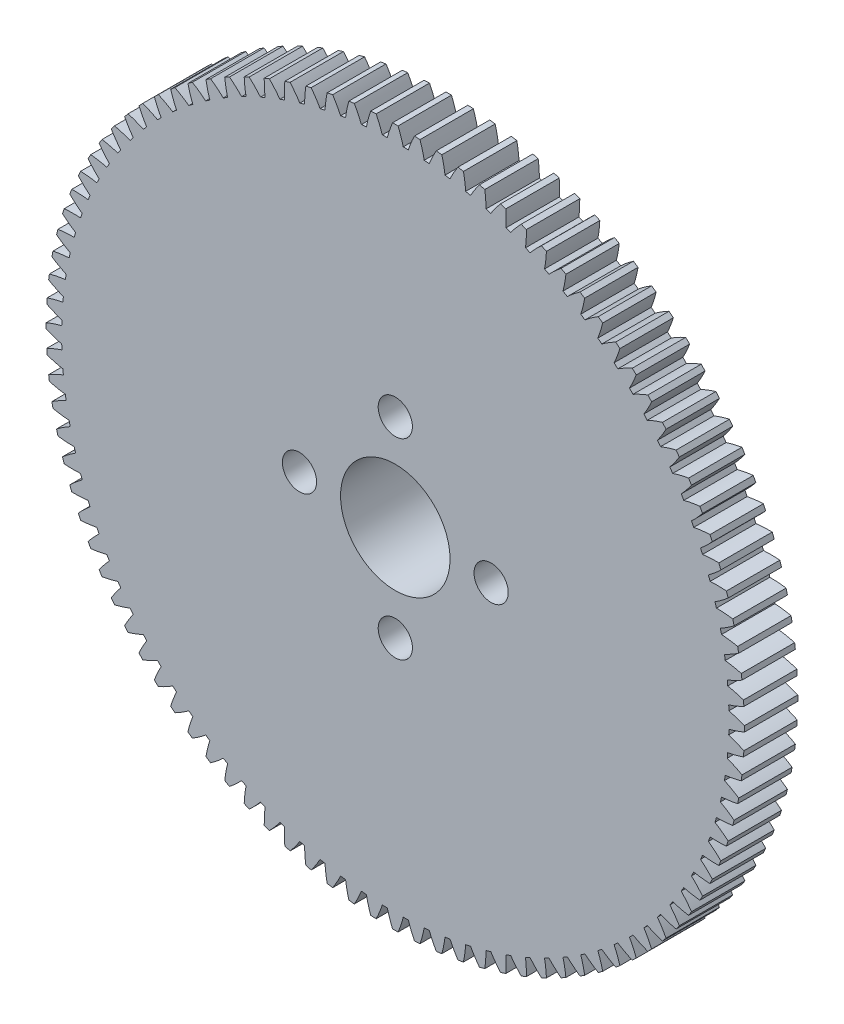
from build123d import *

# Parameters (mm, degrees)
BOSS_EXTRUDE1_DEPTH = 3.9
SKETCH3_R           = 10
BOSS_EXTRUDE2_DEPTH = 4
SKETCH2_R           = 4
SKETCH2_R_2         = 1.25
CUT_EXTRUDE1_DEPTH  = 37.916507893


with BuildPart() as part:
    # Sketch1 → Boss-Extrude1 (new body)
    with BuildSketch(Plane.XY.offset(4.1)):
        with BuildLine():
            Line((25.499201507, -0.201798183), (25.499201507, 0.201798183))
            ThreePointArc((25.499201507, 0.201798183), (24.94053741, 0.412222952), (24.368062617, 0.581506053))
            ThreePointArc((24.368062617, 0.581506053), (24.362972409, 0.765637253), (24.356490879, 0.949724728))
            ThreePointArc((24.356490879, 0.949724728), (24.917148309, 1.154763051), (25.46155567, 1.39970813))
            Line((25.46155567, 1.39970813), (25.436213645, 1.802508091))
            ThreePointArc((25.436213645, 1.802508091), (24.865439263, 1.977438825), (24.283464745, 2.110441895))
            ThreePointArc((24.283464745, 2.110441895), (24.266822887, 2.293890137), (24.248795199, 2.47720738))
            ThreePointArc((24.248795199, 2.47720738), (24.795471836, 2.717045077), (25.323424706, 2.995690434))
            Line((25.323424706, 2.995690434), (25.272840668, 3.396104322))
            ThreePointArc((25.272840668, 3.396104322), (24.692208588, 3.534850651), (24.103031131, 3.631048787))
            ThreePointArc((24.103031131, 3.631048787), (24.074903302, 3.813090085), (24.045400602, 3.994913625))
            ThreePointArc((24.045400602, 3.994913625), (24.575938965, 4.268604168), (25.085353753, 4.579850117))
            Line((25.085353753, 4.579850117), (25.009727335, 4.976297682))
            ThreePointArc((25.009727335, 4.976297682), (24.421529045, 5.078312037), (23.827473865, 5.137325589))
            ThreePointArc((23.827473865, 5.137325589), (23.787971072, 5.317241509), (23.747109795, 5.496853772))
            ThreePointArc((23.747109795, 5.496853772), (24.25941609, 5.803317028), (24.748282369, 6.145935223))
            Line((24.748282369, 6.145935223), (24.647912034, 6.536851868))
            ThreePointArc((24.647912034, 6.536851868), (24.054468885, 6.601731644), (23.457880446, 6.623327714))
            ThreePointArc((23.457880446, 6.623327714), (23.407158588, 6.80040821), (23.355099994, 6.977100348))
            ThreePointArc((23.355099994, 6.977100348), (23.847152382, 7.315126847), (24.313540822, 7.687765132))
            Line((24.313540822, 7.687765132), (24.188822685, 8.071608086))
            ThreePointArc((24.188822685, 8.071608086), (23.592476726, 8.099097233), (22.995709489, 8.083190589))
            ThreePointArc((22.995709489, 8.083190589), (22.933968743, 8.256736806), (22.870918284, 8.429811496))
            ThreePointArc((22.870918284, 8.429811496), (23.340774859, 8.798067203), (23.782844836, 9.199254943))
            Line((23.782844836, 9.199254943), (23.634271104, 9.574509354))
            ThreePointArc((23.634271104, 9.574509354), (23.037375839, 9.564499385), (22.442784972, 9.511152805))
            ThreePointArc((22.442784972, 9.511152805), (22.370269001, 9.680479834), (22.296475507, 9.84925403))
            ThreePointArc((22.296475507, 9.84925403), (22.742281961, 10.246285607), (23.158288827, 10.674439498))
            Line((23.158288827, 10.674439498), (22.986445852, 11.039624408))
            ThreePointArc((22.986445852, 11.039624408), (22.391356955, 10.992154828), (21.801289037, 10.901578846))
            ThreePointArc((21.801289037, 10.901578846), (21.718284027, 11.066018431), (21.634038729, 11.229826058))
            ThreePointArc((21.634038729, 11.229826058), (22.054035666, 11.654066602), (22.442337633, 12.107496917))
            Line((22.442337633, 12.107496917), (22.2479036, 12.461171109))
            ThreePointArc((22.2479036, 12.461171109), (21.656969615, 12.376429258), (21.073753374, 12.248981335))
            ThreePointArc((21.073753374, 12.248981335), (20.980586908, 12.407884509), (20.886222283, 12.566079093))
            ThreePointArc((20.886222283, 12.566079093), (21.278752168, 13.015854321), (21.637816784, 13.492771577))
            Line((21.637816784, 13.492771577), (21.421559037, 13.833539259))
            ThreePointArc((21.421559037, 13.833539259), (20.837112109, 13.711859575), (20.263049233, 13.548042691))
            ThreePointArc((20.263049233, 13.548042691), (20.160088998, 13.700782335), (20.055977459, 13.852739554))
            ThreePointArc((20.055977459, 13.852739554), (20.419491156, 14.326274409), (20.747901358, 14.824796431))
            Line((20.747901358, 14.824796431), (20.510673366, 15.151312751))
            ThreePointArc((20.510673366, 15.151312751), (19.935020042, 14.993175447), (19.372376095, 14.793636112))
            ThreePointArc((19.372376095, 14.793636112), (19.260028427, 14.939609433), (19.146580856, 15.084729581))
            ThreePointArc((19.146580856, 15.084729581), (19.479643742, 15.580155238), (19.776103444, 16.098314587))
            Line((19.776103444, 16.098314587), (19.518841438, 16.409290932))
            ThreePointArc((19.518841438, 16.409290932), (18.954253558, 16.215320106), (18.405249039, 15.98084581))
            ThreePointArc((18.405249039, 15.98084581), (18.283957322, 16.119476717), (18.161621444, 16.257187072))
            ThreePointArc((18.161621444, 16.257187072), (18.462919073, 16.772548311), (18.726258285, 17.30830005))
            Line((18.726258285, 17.30830005), (18.449977561, 17.60250914))
            ThreePointArc((18.449977561, 17.60250914), (17.898683294, 17.373470304), (17.365484873, 17.104986411))
            ThreePointArc((17.365484873, 17.104986411), (17.235727791, 17.235727791), (17.104986411, 17.365484873))
            ThreePointArc((17.104986411, 17.365484873), (17.373329697, 17.898747799), (17.60250914, 18.449977561))
            Line((17.60250914, 18.449977561), (17.30830005, 18.726258285))
            ThreePointArc((17.30830005, 18.726258285), (16.772475105, 18.463055352), (16.257187072, 18.161621444))
            ThreePointArc((16.257187072, 18.161621444), (16.119476717, 18.283957322), (15.98084581, 18.405249039))
            ThreePointArc((15.98084581, 18.405249039), (16.215175727, 18.954309106), (16.409290932, 19.518841438))
            Line((16.409290932, 19.518841438), (16.098314587, 19.776103444))
            ThreePointArc((16.098314587, 19.776103444), (15.580073619, 19.479775155), (15.084729581, 19.146580856))
            ThreePointArc((15.084729581, 19.146580856), (14.939609433, 19.260028427), (14.793636112, 19.372376095))
            ThreePointArc((14.793636112, 19.372376095), (14.993027865, 19.935066415), (15.151312751, 20.510673366))
            Line((15.151312751, 20.510673366), (14.824796431, 20.747901358))
            ThreePointArc((14.824796431, 20.747901358), (14.3261847, 20.419617185), (13.852739554, 20.055977459))
            ThreePointArc((13.852739554, 20.055977459), (13.700782335, 20.160088998), (13.548042691, 20.263049233))
            ThreePointArc((13.548042691, 20.263049233), (13.711709373, 20.837149124), (13.833539259, 21.421559037))
            Line((13.833539259, 21.421559037), (13.492771577, 21.637816784))
            ThreePointArc((13.492771577, 21.637816784), (13.015756876, 21.278872315), (12.566079093, 20.886222283))
            ThreePointArc((12.566079093, 20.886222283), (12.407884509, 20.980586908), (12.248981335, 21.073753374))
            ThreePointArc((12.248981335, 21.073753374), (12.376277027, 21.656997125), (12.461171109, 22.2479036))
            Line((12.461171109, 22.2479036), (12.107496917, 22.442337633))
            ThreePointArc((12.107496917, 22.442337633), (11.653961805, 22.054149458), (11.229826058, 21.634038729))
            ThreePointArc((11.229826058, 21.634038729), (11.066018431, 21.718284027), (10.901578846, 21.801289037))
            ThreePointArc((10.901578846, 21.801289037), (10.992001171, 22.391374853), (11.039624408, 22.986445852))
            Line((11.039624408, 22.986445852), (10.674439498, 23.158288827))
            ThreePointArc((10.674439498, 23.158288827), (10.246173871, 22.742388948), (9.84925403, 22.296475507))
            ThreePointArc((9.84925403, 22.296475507), (9.680479834, 22.370269001), (9.511152805, 22.442784972))
            ThreePointArc((9.511152805, 22.442784972), (9.564344907, 23.037384054), (9.574509354, 23.634271104))
            Line((9.574509354, 23.634271104), (9.199254943, 23.782844836))
            ThreePointArc((9.199254943, 23.782844836), (8.79794897, 23.340874619), (8.429811496, 22.870918284))
            ThreePointArc((8.429811496, 22.870918284), (8.256736806, 22.933968743), (8.083190589, 22.995709489))
            ThreePointArc((8.083190589, 22.995709489), (8.098942544, 23.592475224), (8.071608086, 24.188822685))
            Line((8.071608086, 24.188822685), (7.687765132, 24.313540822))
            ThreePointArc((7.687765132, 24.313540822), (7.315002584, 23.847244521), (6.977100348, 23.355099994))
            ThreePointArc((6.977100348, 23.355099994), (6.80040821, 23.407158588), (6.623327714, 23.457880446))
            ThreePointArc((6.623327714, 23.457880446), (6.601577355, 24.054457674), (6.536851868, 24.647912034))
            Line((6.536851868, 24.647912034), (6.145935223, 24.748282369))
            ThreePointArc((6.145935223, 24.748282369), (5.803187224, 24.259500244), (5.496853772, 23.747109795))
            ThreePointArc((5.496853772, 23.747109795), (5.317241509, 23.787971072), (5.137325589, 23.827473865))
            ThreePointArc((5.137325589, 23.827473865), (5.078158755, 24.421508168), (4.976297682, 25.009727335))
            Line((4.976297682, 25.009727335), (4.579850117, 25.085353753))
            ThreePointArc((4.579850117, 25.085353753), (4.268469336, 24.576014803), (3.994913625, 24.045400602))
            ThreePointArc((3.994913625, 24.045400602), (3.813090085, 24.074903302), (3.631048787, 24.103031131))
            ThreePointArc((3.631048787, 24.103031131), (3.534698983, 24.692178127), (3.396104322, 25.272840668))
            Line((3.396104322, 25.272840668), (2.995690434, 25.323424706))
            ThreePointArc((2.995690434, 25.323424706), (2.71690575, 24.795539059), (2.47720738, 24.248795199))
            ThreePointArc((2.47720738, 24.248795199), (2.293890137, 24.266822887), (2.110441895, 24.283464745))
            ThreePointArc((2.110441895, 24.283464745), (1.97728937, 24.865399339), (1.802508091, 25.436213645))
            Line((1.802508091, 25.436213645), (1.39970813, 25.46155567))
            ThreePointArc((1.39970813, 25.46155567), (1.154619777, 24.91720665), (0.949724728, 24.356490879))
            ThreePointArc((0.949724728, 24.356490879), (0.765637253, 24.362972409), (0.581506053, 24.368062617))
            ThreePointArc((0.581506053, 24.368062617), (0.412076298, 24.94048818), (0.201798183, 25.499201507))
            Line((0.201798183, 25.499201507), (-0.201798183, 25.499201507))
            ThreePointArc((-0.201798183, 25.499201507), (-0.412222952, 24.94053741), (-0.581506053, 24.368062617))
            ThreePointArc((-0.581506053, 24.368062617), (-0.765637253, 24.362972409), (-0.949724728, 24.356490879))
            ThreePointArc((-0.949724728, 24.356490879), (-1.154763051, 24.917148309), (-1.39970813, 25.46155567))
            Line((-1.39970813, 25.46155567), (-1.802508091, 25.436213645))
            ThreePointArc((-1.802508091, 25.436213645), (-1.977438825, 24.865439263), (-2.110441895, 24.283464745))
            ThreePointArc((-2.110441895, 24.283464745), (-2.293890137, 24.266822887), (-2.47720738, 24.248795199))
            ThreePointArc((-2.47720738, 24.248795199), (-2.717045077, 24.795471836), (-2.995690434, 25.323424706))
            Line((-2.995690434, 25.323424706), (-3.396104322, 25.272840668))
            ThreePointArc((-3.396104322, 25.272840668), (-3.534850651, 24.692208588), (-3.631048787, 24.103031131))
            ThreePointArc((-3.631048787, 24.103031131), (-3.813090085, 24.074903302), (-3.994913625, 24.045400602))
            ThreePointArc((-3.994913625, 24.045400602), (-4.268604168, 24.575938965), (-4.579850117, 25.085353753))
            Line((-4.579850117, 25.085353753), (-4.976297682, 25.009727335))
            ThreePointArc((-4.976297682, 25.009727335), (-5.078312037, 24.421529045), (-5.137325589, 23.827473865))
            ThreePointArc((-5.137325589, 23.827473865), (-5.317241509, 23.787971072), (-5.496853772, 23.747109795))
            ThreePointArc((-5.496853772, 23.747109795), (-5.803317028, 24.25941609), (-6.145935223, 24.748282369))
            Line((-6.145935223, 24.748282369), (-6.536851868, 24.647912034))
            ThreePointArc((-6.536851868, 24.647912034), (-6.601731644, 24.054468885), (-6.623327714, 23.457880446))
            ThreePointArc((-6.623327714, 23.457880446), (-6.80040821, 23.407158588), (-6.977100348, 23.355099994))
            ThreePointArc((-6.977100348, 23.355099994), (-7.315126847, 23.847152382), (-7.687765132, 24.313540822))
            Line((-7.687765132, 24.313540822), (-8.071608086, 24.188822685))
            ThreePointArc((-8.071608086, 24.188822685), (-8.099097233, 23.592476726), (-8.083190589, 22.995709489))
            ThreePointArc((-8.083190589, 22.995709489), (-8.256736806, 22.933968743), (-8.429811496, 22.870918284))
            ThreePointArc((-8.429811496, 22.870918284), (-8.798067203, 23.340774859), (-9.199254943, 23.782844836))
            Line((-9.199254943, 23.782844836), (-9.574509354, 23.634271104))
            ThreePointArc((-9.574509354, 23.634271104), (-9.564499385, 23.037375839), (-9.511152805, 22.442784972))
            ThreePointArc((-9.511152805, 22.442784972), (-9.680479834, 22.370269001), (-9.84925403, 22.296475507))
            ThreePointArc((-9.84925403, 22.296475507), (-10.246285607, 22.742281961), (-10.674439498, 23.158288827))
            Line((-10.674439498, 23.158288827), (-11.039624408, 22.986445852))
            ThreePointArc((-11.039624408, 22.986445852), (-10.992154828, 22.391356955), (-10.901578846, 21.801289037))
            ThreePointArc((-10.901578846, 21.801289037), (-11.066018431, 21.718284027), (-11.229826058, 21.634038729))
            ThreePointArc((-11.229826058, 21.634038729), (-11.654066602, 22.054035666), (-12.107496917, 22.442337633))
            Line((-12.107496917, 22.442337633), (-12.461171109, 22.2479036))
            ThreePointArc((-12.461171109, 22.2479036), (-12.376429258, 21.656969615), (-12.248981335, 21.073753374))
            ThreePointArc((-12.248981335, 21.073753374), (-12.407884509, 20.980586908), (-12.566079093, 20.886222283))
            ThreePointArc((-12.566079093, 20.886222283), (-13.015854321, 21.278752168), (-13.492771577, 21.637816784))
            Line((-13.492771577, 21.637816784), (-13.833539259, 21.421559037))
            ThreePointArc((-13.833539259, 21.421559037), (-13.711859575, 20.837112109), (-13.548042691, 20.263049233))
            ThreePointArc((-13.548042691, 20.263049233), (-13.700782335, 20.160088998), (-13.852739554, 20.055977459))
            ThreePointArc((-13.852739554, 20.055977459), (-14.326274409, 20.419491156), (-14.824796431, 20.747901358))
            Line((-14.824796431, 20.747901358), (-15.151312751, 20.510673366))
            ThreePointArc((-15.151312751, 20.510673366), (-14.993175447, 19.935020042), (-14.793636112, 19.372376095))
            ThreePointArc((-14.793636112, 19.372376095), (-14.939609433, 19.260028427), (-15.084729581, 19.146580856))
            ThreePointArc((-15.084729581, 19.146580856), (-15.580155238, 19.479643742), (-16.098314587, 19.776103444))
            Line((-16.098314587, 19.776103444), (-16.409290932, 19.518841438))
            ThreePointArc((-16.409290932, 19.518841438), (-16.215320106, 18.954253558), (-15.98084581, 18.405249039))
            ThreePointArc((-15.98084581, 18.405249039), (-16.119476717, 18.283957322), (-16.257187072, 18.161621444))
            ThreePointArc((-16.257187072, 18.161621444), (-16.772548311, 18.462919073), (-17.30830005, 18.726258285))
            Line((-17.30830005, 18.726258285), (-17.60250914, 18.449977561))
            ThreePointArc((-17.60250914, 18.449977561), (-17.373470304, 17.898683294), (-17.104986411, 17.365484873))
            ThreePointArc((-17.104986411, 17.365484873), (-17.235727791, 17.235727791), (-17.365484873, 17.104986411))
            ThreePointArc((-17.365484873, 17.104986411), (-17.898747799, 17.373329697), (-18.449977561, 17.60250914))
            Line((-18.449977561, 17.60250914), (-18.726258285, 17.30830005))
            ThreePointArc((-18.726258285, 17.30830005), (-18.463055352, 16.772475105), (-18.161621444, 16.257187072))
            ThreePointArc((-18.161621444, 16.257187072), (-18.283957322, 16.119476717), (-18.405249039, 15.98084581))
            ThreePointArc((-18.405249039, 15.98084581), (-18.954309106, 16.215175727), (-19.518841438, 16.409290932))
            Line((-19.518841438, 16.409290932), (-19.776103444, 16.098314587))
            ThreePointArc((-19.776103444, 16.098314587), (-19.479775155, 15.580073619), (-19.146580856, 15.084729581))
            ThreePointArc((-19.146580856, 15.084729581), (-19.260028427, 14.939609433), (-19.372376095, 14.793636112))
            ThreePointArc((-19.372376095, 14.793636112), (-19.935066415, 14.993027865), (-20.510673366, 15.151312751))
            Line((-20.510673366, 15.151312751), (-20.747901358, 14.824796431))
            ThreePointArc((-20.747901358, 14.824796431), (-20.419617185, 14.3261847), (-20.055977459, 13.852739554))
            ThreePointArc((-20.055977459, 13.852739554), (-20.160088998, 13.700782335), (-20.263049233, 13.548042691))
            ThreePointArc((-20.263049233, 13.548042691), (-20.837149124, 13.711709373), (-21.421559037, 13.833539259))
            Line((-21.421559037, 13.833539259), (-21.637816784, 13.492771577))
            ThreePointArc((-21.637816784, 13.492771577), (-21.278872315, 13.015756876), (-20.886222283, 12.566079093))
            ThreePointArc((-20.886222283, 12.566079093), (-20.980586908, 12.407884509), (-21.073753374, 12.248981335))
            ThreePointArc((-21.073753374, 12.248981335), (-21.656997125, 12.376277027), (-22.2479036, 12.461171109))
            Line((-22.2479036, 12.461171109), (-22.442337633, 12.107496917))
            ThreePointArc((-22.442337633, 12.107496917), (-22.054149458, 11.653961805), (-21.634038729, 11.229826058))
            ThreePointArc((-21.634038729, 11.229826058), (-21.718284027, 11.066018431), (-21.801289037, 10.901578846))
            ThreePointArc((-21.801289037, 10.901578846), (-22.391374853, 10.992001171), (-22.986445852, 11.039624408))
            Line((-22.986445852, 11.039624408), (-23.158288827, 10.674439498))
            ThreePointArc((-23.158288827, 10.674439498), (-22.742388948, 10.246173871), (-22.296475507, 9.84925403))
            ThreePointArc((-22.296475507, 9.84925403), (-22.370269001, 9.680479834), (-22.442784972, 9.511152805))
            ThreePointArc((-22.442784972, 9.511152805), (-23.037384054, 9.564344907), (-23.634271104, 9.574509354))
            Line((-23.634271104, 9.574509354), (-23.782844836, 9.199254943))
            ThreePointArc((-23.782844836, 9.199254943), (-23.340874619, 8.79794897), (-22.870918284, 8.429811496))
            ThreePointArc((-22.870918284, 8.429811496), (-22.933968743, 8.256736806), (-22.995709489, 8.083190589))
            ThreePointArc((-22.995709489, 8.083190589), (-23.592475224, 8.098942544), (-24.188822685, 8.071608086))
            Line((-24.188822685, 8.071608086), (-24.313540822, 7.687765132))
            ThreePointArc((-24.313540822, 7.687765132), (-23.847244521, 7.315002584), (-23.355099994, 6.977100348))
            ThreePointArc((-23.355099994, 6.977100348), (-23.407158588, 6.80040821), (-23.457880446, 6.623327714))
            ThreePointArc((-23.457880446, 6.623327714), (-24.054457674, 6.601577355), (-24.647912034, 6.536851868))
            Line((-24.647912034, 6.536851868), (-24.748282369, 6.145935223))
            ThreePointArc((-24.748282369, 6.145935223), (-24.259500244, 5.803187224), (-23.747109795, 5.496853772))
            ThreePointArc((-23.747109795, 5.496853772), (-23.787971072, 5.317241509), (-23.827473865, 5.137325589))
            ThreePointArc((-23.827473865, 5.137325589), (-24.421508168, 5.078158755), (-25.009727335, 4.976297682))
            Line((-25.009727335, 4.976297682), (-25.085353753, 4.579850117))
            ThreePointArc((-25.085353753, 4.579850117), (-24.576014803, 4.268469336), (-24.045400602, 3.994913625))
            ThreePointArc((-24.045400602, 3.994913625), (-24.074903302, 3.813090085), (-24.103031131, 3.631048787))
            ThreePointArc((-24.103031131, 3.631048787), (-24.692178127, 3.534698983), (-25.272840668, 3.396104322))
            Line((-25.272840668, 3.396104322), (-25.323424706, 2.995690434))
            ThreePointArc((-25.323424706, 2.995690434), (-24.795539059, 2.71690575), (-24.248795199, 2.47720738))
            ThreePointArc((-24.248795199, 2.47720738), (-24.266822887, 2.293890137), (-24.283464745, 2.110441895))
            ThreePointArc((-24.283464745, 2.110441895), (-24.865399339, 1.97728937), (-25.436213645, 1.802508091))
            Line((-25.436213645, 1.802508091), (-25.46155567, 1.39970813))
            ThreePointArc((-25.46155567, 1.39970813), (-24.91720665, 1.154619777), (-24.356490879, 0.949724728))
            ThreePointArc((-24.356490879, 0.949724728), (-24.362972409, 0.765637253), (-24.368062617, 0.581506053))
            ThreePointArc((-24.368062617, 0.581506053), (-24.94048818, 0.412076298), (-25.499201507, 0.201798183))
            Line((-25.499201507, 0.201798183), (-25.499201507, -0.201798183))
            ThreePointArc((-25.499201507, -0.201798183), (-24.94053741, -0.412222952), (-24.368062617, -0.581506053))
            ThreePointArc((-24.368062617, -0.581506053), (-24.362972409, -0.765637253), (-24.356490879, -0.949724728))
            ThreePointArc((-24.356490879, -0.949724728), (-24.917148309, -1.154763051), (-25.46155567, -1.39970813))
            Line((-25.46155567, -1.39970813), (-25.436213645, -1.802508091))
            ThreePointArc((-25.436213645, -1.802508091), (-24.865439263, -1.977438825), (-24.283464745, -2.110441895))
            ThreePointArc((-24.283464745, -2.110441895), (-24.266822887, -2.293890137), (-24.248795199, -2.47720738))
            ThreePointArc((-24.248795199, -2.47720738), (-24.795471836, -2.717045077), (-25.323424706, -2.995690434))
            Line((-25.323424706, -2.995690434), (-25.272840668, -3.396104322))
            ThreePointArc((-25.272840668, -3.396104322), (-24.692208588, -3.534850651), (-24.103031131, -3.631048787))
            ThreePointArc((-24.103031131, -3.631048787), (-24.074903302, -3.813090085), (-24.045400602, -3.994913625))
            ThreePointArc((-24.045400602, -3.994913625), (-24.575938965, -4.268604168), (-25.085353753, -4.579850117))
            Line((-25.085353753, -4.579850117), (-25.009727335, -4.976297682))
            ThreePointArc((-25.009727335, -4.976297682), (-24.421529045, -5.078312037), (-23.827473865, -5.137325589))
            ThreePointArc((-23.827473865, -5.137325589), (-23.787971072, -5.317241509), (-23.747109795, -5.496853772))
            ThreePointArc((-23.747109795, -5.496853772), (-24.25941609, -5.803317028), (-24.748282369, -6.145935223))
            Line((-24.748282369, -6.145935223), (-24.647912034, -6.536851868))
            ThreePointArc((-24.647912034, -6.536851868), (-24.054468885, -6.601731644), (-23.457880446, -6.623327714))
            ThreePointArc((-23.457880446, -6.623327714), (-23.407158588, -6.80040821), (-23.355099994, -6.977100348))
            ThreePointArc((-23.355099994, -6.977100348), (-23.847152382, -7.315126847), (-24.313540822, -7.687765132))
            Line((-24.313540822, -7.687765132), (-24.188822685, -8.071608086))
            ThreePointArc((-24.188822685, -8.071608086), (-23.592476726, -8.099097233), (-22.995709489, -8.083190589))
            ThreePointArc((-22.995709489, -8.083190589), (-22.933968743, -8.256736806), (-22.870918284, -8.429811496))
            ThreePointArc((-22.870918284, -8.429811496), (-23.340774859, -8.798067203), (-23.782844836, -9.199254943))
            Line((-23.782844836, -9.199254943), (-23.634271104, -9.574509354))
            ThreePointArc((-23.634271104, -9.574509354), (-23.037375839, -9.564499385), (-22.442784972, -9.511152805))
            ThreePointArc((-22.442784972, -9.511152805), (-22.370269001, -9.680479834), (-22.296475507, -9.84925403))
            ThreePointArc((-22.296475507, -9.84925403), (-22.742281961, -10.246285607), (-23.158288827, -10.674439498))
            Line((-23.158288827, -10.674439498), (-22.986445852, -11.039624408))
            ThreePointArc((-22.986445852, -11.039624408), (-22.391356955, -10.992154828), (-21.801289037, -10.901578846))
            ThreePointArc((-21.801289037, -10.901578846), (-21.718284027, -11.066018431), (-21.634038729, -11.229826058))
            ThreePointArc((-21.634038729, -11.229826058), (-22.054035666, -11.654066602), (-22.442337633, -12.107496917))
            Line((-22.442337633, -12.107496917), (-22.2479036, -12.461171109))
            ThreePointArc((-22.2479036, -12.461171109), (-21.656969615, -12.376429258), (-21.073753374, -12.248981335))
            ThreePointArc((-21.073753374, -12.248981335), (-20.980586908, -12.407884509), (-20.886222283, -12.566079093))
            ThreePointArc((-20.886222283, -12.566079093), (-21.278752168, -13.015854321), (-21.637816784, -13.492771577))
            Line((-21.637816784, -13.492771577), (-21.421559037, -13.833539259))
            ThreePointArc((-21.421559037, -13.833539259), (-20.837112109, -13.711859575), (-20.263049233, -13.548042691))
            ThreePointArc((-20.263049233, -13.548042691), (-20.160088998, -13.700782335), (-20.055977459, -13.852739554))
            ThreePointArc((-20.055977459, -13.852739554), (-20.419491156, -14.326274409), (-20.747901358, -14.824796431))
            Line((-20.747901358, -14.824796431), (-20.510673366, -15.151312751))
            ThreePointArc((-20.510673366, -15.151312751), (-19.935020042, -14.993175447), (-19.372376095, -14.793636112))
            ThreePointArc((-19.372376095, -14.793636112), (-19.260028427, -14.939609433), (-19.146580856, -15.084729581))
            ThreePointArc((-19.146580856, -15.084729581), (-19.479643742, -15.580155238), (-19.776103444, -16.098314587))
            Line((-19.776103444, -16.098314587), (-19.518841438, -16.409290932))
            ThreePointArc((-19.518841438, -16.409290932), (-18.954253558, -16.215320106), (-18.405249039, -15.98084581))
            ThreePointArc((-18.405249039, -15.98084581), (-18.283957322, -16.119476717), (-18.161621444, -16.257187072))
            ThreePointArc((-18.161621444, -16.257187072), (-18.462919073, -16.772548311), (-18.726258285, -17.30830005))
            Line((-18.726258285, -17.30830005), (-18.449977561, -17.60250914))
            ThreePointArc((-18.449977561, -17.60250914), (-17.898683294, -17.373470304), (-17.365484873, -17.104986411))
            ThreePointArc((-17.365484873, -17.104986411), (-17.235727791, -17.235727791), (-17.104986411, -17.365484873))
            ThreePointArc((-17.104986411, -17.365484873), (-17.373329697, -17.898747799), (-17.60250914, -18.449977561))
            Line((-17.60250914, -18.449977561), (-17.30830005, -18.726258285))
            ThreePointArc((-17.30830005, -18.726258285), (-16.772475105, -18.463055352), (-16.257187072, -18.161621444))
            ThreePointArc((-16.257187072, -18.161621444), (-16.119476717, -18.283957322), (-15.98084581, -18.405249039))
            ThreePointArc((-15.98084581, -18.405249039), (-16.215175727, -18.954309106), (-16.409290932, -19.518841438))
            Line((-16.409290932, -19.518841438), (-16.098314587, -19.776103444))
            ThreePointArc((-16.098314587, -19.776103444), (-15.580073619, -19.479775155), (-15.084729581, -19.146580856))
            ThreePointArc((-15.084729581, -19.146580856), (-14.939609433, -19.260028427), (-14.793636112, -19.372376095))
            ThreePointArc((-14.793636112, -19.372376095), (-14.993027865, -19.935066415), (-15.151312751, -20.510673366))
            Line((-15.151312751, -20.510673366), (-14.824796431, -20.747901358))
            ThreePointArc((-14.824796431, -20.747901358), (-14.3261847, -20.419617185), (-13.852739554, -20.055977459))
            ThreePointArc((-13.852739554, -20.055977459), (-13.700782335, -20.160088998), (-13.548042691, -20.263049233))
            ThreePointArc((-13.548042691, -20.263049233), (-13.711709373, -20.837149124), (-13.833539259, -21.421559037))
            Line((-13.833539259, -21.421559037), (-13.492771577, -21.637816784))
            ThreePointArc((-13.492771577, -21.637816784), (-13.015756876, -21.278872315), (-12.566079093, -20.886222283))
            ThreePointArc((-12.566079093, -20.886222283), (-12.407884509, -20.980586908), (-12.248981335, -21.073753374))
            ThreePointArc((-12.248981335, -21.073753374), (-12.376277027, -21.656997125), (-12.461171109, -22.2479036))
            Line((-12.461171109, -22.2479036), (-12.107496917, -22.442337633))
            ThreePointArc((-12.107496917, -22.442337633), (-11.653961805, -22.054149458), (-11.229826058, -21.634038729))
            ThreePointArc((-11.229826058, -21.634038729), (-11.066018431, -21.718284027), (-10.901578846, -21.801289037))
            ThreePointArc((-10.901578846, -21.801289037), (-10.992001171, -22.391374853), (-11.039624408, -22.986445852))
            Line((-11.039624408, -22.986445852), (-10.674439498, -23.158288827))
            ThreePointArc((-10.674439498, -23.158288827), (-10.246173871, -22.742388948), (-9.84925403, -22.296475507))
            ThreePointArc((-9.84925403, -22.296475507), (-9.680479834, -22.370269001), (-9.511152805, -22.442784972))
            ThreePointArc((-9.511152805, -22.442784972), (-9.564344907, -23.037384054), (-9.574509354, -23.634271104))
            Line((-9.574509354, -23.634271104), (-9.199254943, -23.782844836))
            ThreePointArc((-9.199254943, -23.782844836), (-8.79794897, -23.340874619), (-8.429811496, -22.870918284))
            ThreePointArc((-8.429811496, -22.870918284), (-8.256736806, -22.933968743), (-8.083190589, -22.995709489))
            ThreePointArc((-8.083190589, -22.995709489), (-8.098942544, -23.592475224), (-8.071608086, -24.188822685))
            Line((-8.071608086, -24.188822685), (-7.687765132, -24.313540822))
            ThreePointArc((-7.687765132, -24.313540822), (-7.315002584, -23.847244521), (-6.977100348, -23.355099994))
            ThreePointArc((-6.977100348, -23.355099994), (-6.80040821, -23.407158588), (-6.623327714, -23.457880446))
            ThreePointArc((-6.623327714, -23.457880446), (-6.601577355, -24.054457674), (-6.536851868, -24.647912034))
            Line((-6.536851868, -24.647912034), (-6.145935223, -24.748282369))
            ThreePointArc((-6.145935223, -24.748282369), (-5.803187224, -24.259500244), (-5.496853772, -23.747109795))
            ThreePointArc((-5.496853772, -23.747109795), (-5.317241509, -23.787971072), (-5.137325589, -23.827473865))
            ThreePointArc((-5.137325589, -23.827473865), (-5.078158755, -24.421508168), (-4.976297682, -25.009727335))
            Line((-4.976297682, -25.009727335), (-4.579850117, -25.085353753))
            ThreePointArc((-4.579850117, -25.085353753), (-4.268469336, -24.576014803), (-3.994913625, -24.045400602))
            ThreePointArc((-3.994913625, -24.045400602), (-3.813090085, -24.074903302), (-3.631048787, -24.103031131))
            ThreePointArc((-3.631048787, -24.103031131), (-3.534698983, -24.692178127), (-3.396104322, -25.272840668))
            Line((-3.396104322, -25.272840668), (-2.995690434, -25.323424706))
            ThreePointArc((-2.995690434, -25.323424706), (-2.71690575, -24.795539059), (-2.47720738, -24.248795199))
            ThreePointArc((-2.47720738, -24.248795199), (-2.293890137, -24.266822887), (-2.110441895, -24.283464745))
            ThreePointArc((-2.110441895, -24.283464745), (-1.97728937, -24.865399339), (-1.802508091, -25.436213645))
            Line((-1.802508091, -25.436213645), (-1.39970813, -25.46155567))
            ThreePointArc((-1.39970813, -25.46155567), (-1.154619777, -24.91720665), (-0.949724728, -24.356490879))
            ThreePointArc((-0.949724728, -24.356490879), (-0.765637253, -24.362972409), (-0.581506053, -24.368062617))
            ThreePointArc((-0.581506053, -24.368062617), (-0.412076298, -24.94048818), (-0.201798183, -25.499201507))
            Line((-0.201798183, -25.499201507), (0.201798183, -25.499201507))
            ThreePointArc((0.201798183, -25.499201507), (0.412222952, -24.94053741), (0.581506053, -24.368062617))
            ThreePointArc((0.581506053, -24.368062617), (0.765637253, -24.362972409), (0.949724728, -24.356490879))
            ThreePointArc((0.949724728, -24.356490879), (1.154763051, -24.917148309), (1.39970813, -25.46155567))
            Line((1.39970813, -25.46155567), (1.802508091, -25.436213645))
            ThreePointArc((1.802508091, -25.436213645), (1.977438825, -24.865439263), (2.110441895, -24.283464745))
            ThreePointArc((2.110441895, -24.283464745), (2.293890137, -24.266822887), (2.47720738, -24.248795199))
            ThreePointArc((2.47720738, -24.248795199), (2.717045077, -24.795471836), (2.995690434, -25.323424706))
            Line((2.995690434, -25.323424706), (3.396104322, -25.272840668))
            ThreePointArc((3.396104322, -25.272840668), (3.534850651, -24.692208588), (3.631048787, -24.103031131))
            ThreePointArc((3.631048787, -24.103031131), (3.813090085, -24.074903302), (3.994913625, -24.045400602))
            ThreePointArc((3.994913625, -24.045400602), (4.268604168, -24.575938965), (4.579850117, -25.085353753))
            Line((4.579850117, -25.085353753), (4.976297682, -25.009727335))
            ThreePointArc((4.976297682, -25.009727335), (5.078312037, -24.421529045), (5.137325589, -23.827473865))
            ThreePointArc((5.137325589, -23.827473865), (5.317241509, -23.787971072), (5.496853772, -23.747109795))
            ThreePointArc((5.496853772, -23.747109795), (5.803317028, -24.25941609), (6.145935223, -24.748282369))
            Line((6.145935223, -24.748282369), (6.536851868, -24.647912034))
            ThreePointArc((6.536851868, -24.647912034), (6.601731644, -24.054468885), (6.623327714, -23.457880446))
            ThreePointArc((6.623327714, -23.457880446), (6.80040821, -23.407158588), (6.977100348, -23.355099994))
            ThreePointArc((6.977100348, -23.355099994), (7.315126847, -23.847152382), (7.687765132, -24.313540822))
            Line((7.687765132, -24.313540822), (8.071608086, -24.188822685))
            ThreePointArc((8.071608086, -24.188822685), (8.099097233, -23.592476726), (8.083190589, -22.995709489))
            ThreePointArc((8.083190589, -22.995709489), (8.256736806, -22.933968743), (8.429811496, -22.870918284))
            ThreePointArc((8.429811496, -22.870918284), (8.798067203, -23.340774859), (9.199254943, -23.782844836))
            Line((9.199254943, -23.782844836), (9.574509354, -23.634271104))
            ThreePointArc((9.574509354, -23.634271104), (9.564499385, -23.037375839), (9.511152805, -22.442784972))
            ThreePointArc((9.511152805, -22.442784972), (9.680479834, -22.370269001), (9.84925403, -22.296475507))
            ThreePointArc((9.84925403, -22.296475507), (10.246285607, -22.742281961), (10.674439498, -23.158288827))
            Line((10.674439498, -23.158288827), (11.039624408, -22.986445852))
            ThreePointArc((11.039624408, -22.986445852), (10.992154828, -22.391356955), (10.901578846, -21.801289037))
            ThreePointArc((10.901578846, -21.801289037), (11.066018431, -21.718284027), (11.229826058, -21.634038729))
            ThreePointArc((11.229826058, -21.634038729), (11.654066602, -22.054035666), (12.107496917, -22.442337633))
            Line((12.107496917, -22.442337633), (12.461171109, -22.2479036))
            ThreePointArc((12.461171109, -22.2479036), (12.376429258, -21.656969615), (12.248981335, -21.073753374))
            ThreePointArc((12.248981335, -21.073753374), (12.407884509, -20.980586908), (12.566079093, -20.886222283))
            ThreePointArc((12.566079093, -20.886222283), (13.015854321, -21.278752168), (13.492771577, -21.637816784))
            Line((13.492771577, -21.637816784), (13.833539259, -21.421559037))
            ThreePointArc((13.833539259, -21.421559037), (13.711859575, -20.837112109), (13.548042691, -20.263049233))
            ThreePointArc((13.548042691, -20.263049233), (13.700782335, -20.160088998), (13.852739554, -20.055977459))
            ThreePointArc((13.852739554, -20.055977459), (14.326274409, -20.419491156), (14.824796431, -20.747901358))
            Line((14.824796431, -20.747901358), (15.151312751, -20.510673366))
            ThreePointArc((15.151312751, -20.510673366), (14.993175447, -19.935020042), (14.793636112, -19.372376095))
            ThreePointArc((14.793636112, -19.372376095), (14.939609433, -19.260028427), (15.084729581, -19.146580856))
            ThreePointArc((15.084729581, -19.146580856), (15.580155238, -19.479643742), (16.098314587, -19.776103444))
            Line((16.098314587, -19.776103444), (16.409290932, -19.518841438))
            ThreePointArc((16.409290932, -19.518841438), (16.215320106, -18.954253558), (15.98084581, -18.405249039))
            ThreePointArc((15.98084581, -18.405249039), (16.119476717, -18.283957322), (16.257187072, -18.161621444))
            ThreePointArc((16.257187072, -18.161621444), (16.772548311, -18.462919073), (17.30830005, -18.726258285))
            Line((17.30830005, -18.726258285), (17.60250914, -18.449977561))
            ThreePointArc((17.60250914, -18.449977561), (17.373470304, -17.898683294), (17.104986411, -17.365484873))
            ThreePointArc((17.104986411, -17.365484873), (17.235727791, -17.235727791), (17.365484873, -17.104986411))
            ThreePointArc((17.365484873, -17.104986411), (17.898747799, -17.373329697), (18.449977561, -17.60250914))
            Line((18.449977561, -17.60250914), (18.726258285, -17.30830005))
            ThreePointArc((18.726258285, -17.30830005), (18.463055352, -16.772475105), (18.161621444, -16.257187072))
            ThreePointArc((18.161621444, -16.257187072), (18.283957322, -16.119476717), (18.405249039, -15.98084581))
            ThreePointArc((18.405249039, -15.98084581), (18.954309106, -16.215175727), (19.518841438, -16.409290932))
            Line((19.518841438, -16.409290932), (19.776103444, -16.098314587))
            ThreePointArc((19.776103444, -16.098314587), (19.479775155, -15.580073619), (19.146580856, -15.084729581))
            ThreePointArc((19.146580856, -15.084729581), (19.260028427, -14.939609433), (19.372376095, -14.793636112))
            ThreePointArc((19.372376095, -14.793636112), (19.935066415, -14.993027865), (20.510673366, -15.151312751))
            Line((20.510673366, -15.151312751), (20.747901358, -14.824796431))
            ThreePointArc((20.747901358, -14.824796431), (20.419617185, -14.3261847), (20.055977459, -13.852739554))
            ThreePointArc((20.055977459, -13.852739554), (20.160088998, -13.700782335), (20.263049233, -13.548042691))
            ThreePointArc((20.263049233, -13.548042691), (20.837149124, -13.711709373), (21.421559037, -13.833539259))
            Line((21.421559037, -13.833539259), (21.637816784, -13.492771577))
            ThreePointArc((21.637816784, -13.492771577), (21.278872315, -13.015756876), (20.886222283, -12.566079093))
            ThreePointArc((20.886222283, -12.566079093), (20.980586908, -12.407884509), (21.073753374, -12.248981335))
            ThreePointArc((21.073753374, -12.248981335), (21.656997125, -12.376277027), (22.2479036, -12.461171109))
            Line((22.2479036, -12.461171109), (22.442337633, -12.107496917))
            ThreePointArc((22.442337633, -12.107496917), (22.054149458, -11.653961805), (21.634038729, -11.229826058))
            ThreePointArc((21.634038729, -11.229826058), (21.718284027, -11.066018431), (21.801289037, -10.901578846))
            ThreePointArc((21.801289037, -10.901578846), (22.391374853, -10.992001171), (22.986445852, -11.039624408))
            Line((22.986445852, -11.039624408), (23.158288827, -10.674439498))
            ThreePointArc((23.158288827, -10.674439498), (22.742388948, -10.246173871), (22.296475507, -9.84925403))
            ThreePointArc((22.296475507, -9.84925403), (22.370269001, -9.680479834), (22.442784972, -9.511152805))
            ThreePointArc((22.442784972, -9.511152805), (23.037384054, -9.564344907), (23.634271104, -9.574509354))
            Line((23.634271104, -9.574509354), (23.782844836, -9.199254943))
            ThreePointArc((23.782844836, -9.199254943), (23.340874619, -8.79794897), (22.870918284, -8.429811496))
            ThreePointArc((22.870918284, -8.429811496), (22.933968743, -8.256736806), (22.995709489, -8.083190589))
            ThreePointArc((22.995709489, -8.083190589), (23.592475224, -8.098942544), (24.188822685, -8.071608086))
            Line((24.188822685, -8.071608086), (24.313540822, -7.687765132))
            ThreePointArc((24.313540822, -7.687765132), (23.847244521, -7.315002584), (23.355099994, -6.977100348))
            ThreePointArc((23.355099994, -6.977100348), (23.407158588, -6.80040821), (23.457880446, -6.623327714))
            ThreePointArc((23.457880446, -6.623327714), (24.054457674, -6.601577355), (24.647912034, -6.536851868))
            Line((24.647912034, -6.536851868), (24.748282369, -6.145935223))
            ThreePointArc((24.748282369, -6.145935223), (24.259500244, -5.803187224), (23.747109795, -5.496853772))
            ThreePointArc((23.747109795, -5.496853772), (23.787971072, -5.317241509), (23.827473865, -5.137325589))
            ThreePointArc((23.827473865, -5.137325589), (24.421508168, -5.078158755), (25.009727335, -4.976297682))
            Line((25.009727335, -4.976297682), (25.085353753, -4.579850117))
            ThreePointArc((25.085353753, -4.579850117), (24.576014803, -4.268469336), (24.045400602, -3.994913625))
            ThreePointArc((24.045400602, -3.994913625), (24.074903302, -3.813090085), (24.103031131, -3.631048787))
            ThreePointArc((24.103031131, -3.631048787), (24.692178127, -3.534698983), (25.272840668, -3.396104322))
            Line((25.272840668, -3.396104322), (25.323424706, -2.995690434))
            ThreePointArc((25.323424706, -2.995690434), (24.795539059, -2.71690575), (24.248795199, -2.47720738))
            ThreePointArc((24.248795199, -2.47720738), (24.266822887, -2.293890137), (24.283464745, -2.110441895))
            ThreePointArc((24.283464745, -2.110441895), (24.865399339, -1.97728937), (25.436213645, -1.802508091))
            Line((25.436213645, -1.802508091), (25.46155567, -1.39970813))
            ThreePointArc((25.46155567, -1.39970813), (24.91720665, -1.154619777), (24.356490879, -0.949724728))
            ThreePointArc((24.356490879, -0.949724728), (24.362972409, -0.765637253), (24.368062617, -0.581506053))
            ThreePointArc((24.368062617, -0.581506053), (24.94048818, -0.412076298), (25.499201507, -0.201798183))
        make_face()
    extrude(amount=-BOSS_EXTRUDE1_DEPTH)

    # Sketch3 → Boss-Extrude2 (add)
    with BuildSketch(Plane(origin=(0, 0, 0.2), x_dir=(-1, 0, 0), z_dir=(0, 0, -1))):
        with Locations(Location((0, 0, 0), (0, 0, 180))):
            Circle(SKETCH3_R)
    extrude(amount=BOSS_EXTRUDE2_DEPTH)

    # Sketch2 → Cut-Extrude1 (cut, through all)
    with BuildSketch(Plane.XY.offset(4.1)):
        Circle(SKETCH2_R)
        with Locations((0, 7)):
            Circle(SKETCH2_R_2)
        with Locations((7, 0)):
            Circle(SKETCH2_R_2)
        with Locations((0, -7)):
            Circle(SKETCH2_R_2)
        with Locations((-7, 0)):
            Circle(SKETCH2_R_2)
    extrude(amount=-CUT_EXTRUDE1_DEPTH, mode=Mode.SUBTRACT)


solid = part.part
